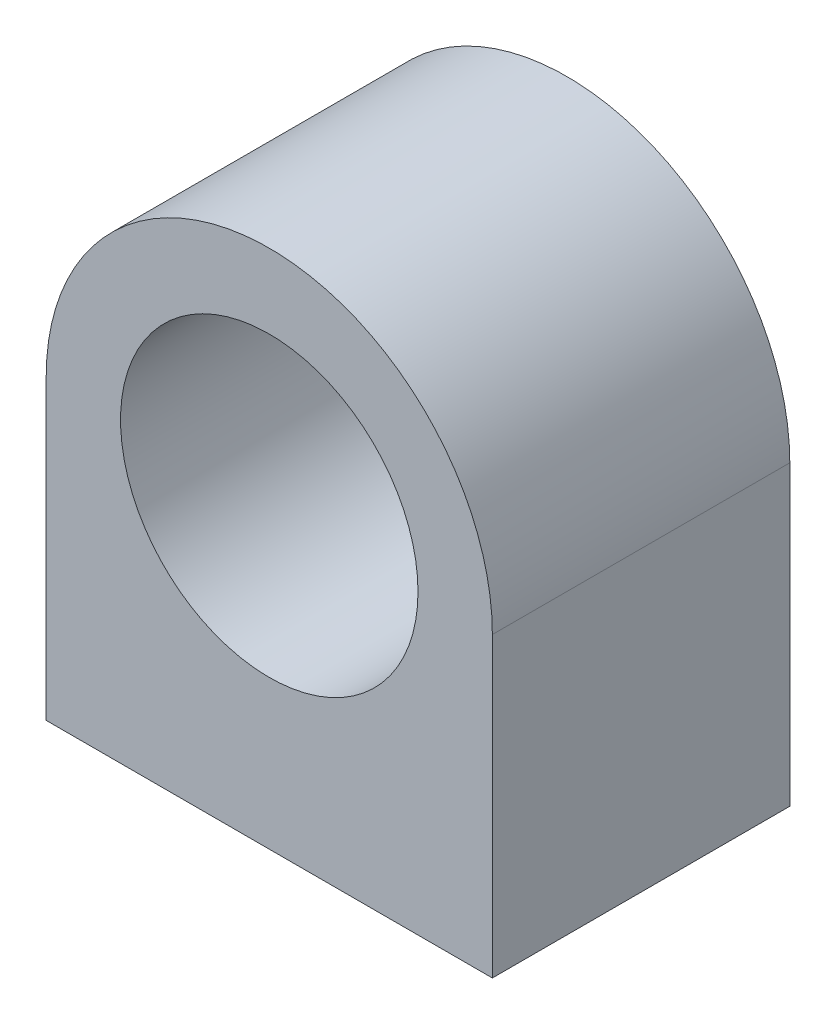
from build123d import *

# Parameters (mm, degrees)
SKETCH1_R           = 12.7
BOSS_EXTRUDE1_DEPTH = 12.7
HOLE1_D             = 6.35
HOLE1_DEPTH         = 12.7


with BuildPart() as part:
    # Sketch1 → Boss-Extrude1 (new, symmetric)
    with BuildSketch(Plane.XY):
        with BuildLine():
            Line((-19.05, 25.4), (-19.05, 0))
            Line((-19.05, 0), (19.05, 0))
            Line((19.05, 0), (19.05, 25.4))
            ThreePointArc((19.05, 25.4), (0, 44.45), (-19.05, 25.4))
        make_face()
        with Locations((0, 25.4)):
            Circle(SKETCH1_R, mode=Mode.SUBTRACT)
    extrude(amount=BOSS_EXTRUDE1_DEPTH, both=True)

    # Hole1
    with Locations(Plane(origin=(0, 0, 0), x_dir=(-1, 0, 0), z_dir=(0, -1, 0))):
        with Locations((-12.7, 0), (12.7, 0)):
            Hole(HOLE1_D / 2, depth=HOLE1_DEPTH)


solid = part.part
